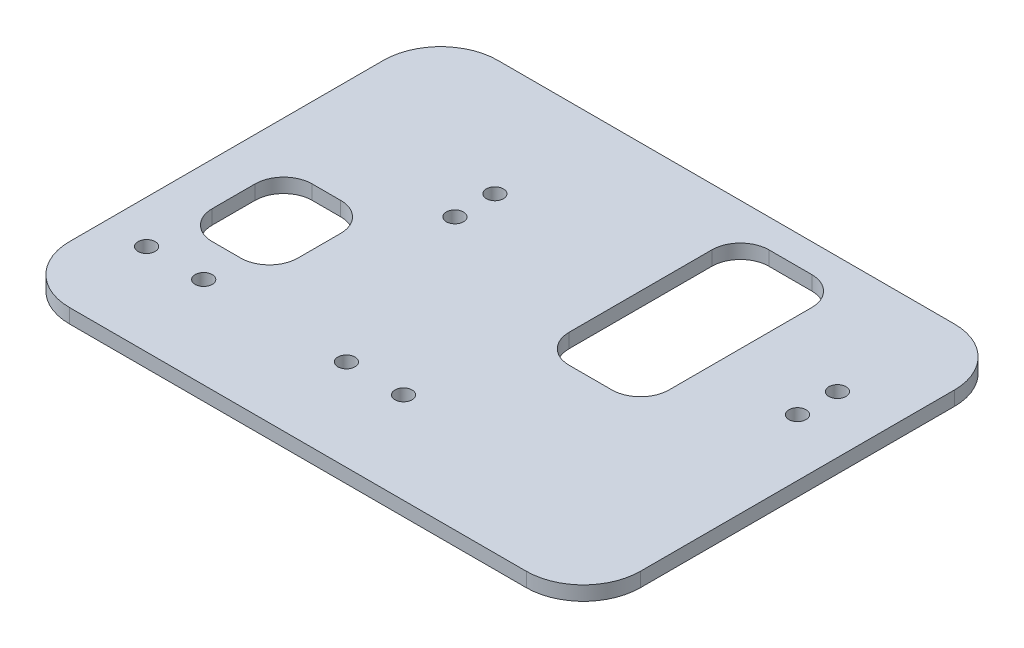
from build123d import *

# Parameters (mm, degrees)
SKETCH1_W           = 200
SKETCH1_H           = 150
BOSS_EXTRUDE1_DEPTH = 5
SKETCH3_R           = 3
CUT_EXTRUDE2_DEPTH  = 10
FILLET1_R           = 20


with BuildPart() as part:
    # Sketch1 → Boss-Extrude1 (new body)
    with BuildSketch(Plane(origin=(0, 0, 0), x_dir=(1, 0, 0), z_dir=(0, 1, 0))):
        with Locations((15, 0)):
            Rectangle(SKETCH1_W, SKETCH1_H)
    extrude(amount=BOSS_EXTRUDE1_DEPTH)

    # Sketch3 → Cut-Extrude2 (cut)
    with BuildSketch(Plane(origin=(0, 5, 0), x_dir=(1, 0, 0), z_dir=(0, 1, 0))):
        with Locations(Location((-70, -43, 0), (0, 0, 270))):
            Circle(SKETCH3_R)
        with Locations(Location((-50, -43, 0), (0, 0, 270))):
            Circle(SKETCH3_R)
        with Locations(Location((0, -43, 0), (0, 0, 270))):
            Circle(SKETCH3_R)
        with Locations(Location((20, -43, 0), (0, 0, 270))):
            Circle(SKETCH3_R)
        with Locations(Location((-25, 20, 0), (0, 0, 270))):
            Circle(SKETCH3_R)
        with Locations(Location((-25, 34, 0), (0, 0, 270))):
            Circle(SKETCH3_R)
        with Locations(Location((95, 20, 0), (0, 0, 270))):
            Circle(SKETCH3_R)
        with Locations(Location((95, 34, 0), (0, 0, 270))):
            Circle(SKETCH3_R)
        with BuildLine():
            Line((40, -5), (55, -5))
            ThreePointArc((55, -5), (62.071067812, -2.071067812), (65, 5))
            Line((65, 5), (65, 55))
            ThreePointArc((65, 55), (62.071067812, 62.071067812), (55, 65))
            Line((55, 65), (40, 65))
            ThreePointArc((40, 65), (32.928932188, 62.071067812), (30, 55))
            Line((30, 55), (30, 5))
            ThreePointArc((30, 5), (32.928932188, -2.071067812), (40, -5))
        make_face()
        with BuildLine():
            Line((-60, -30), (-50, -30))
            ThreePointArc((-50, -30), (-42.928932188, -27.071067812), (-40, -20))
            Line((-40, -20), (-40, -5))
            ThreePointArc((-40, -5), (-42.928932188, 2.071067812), (-50, 5))
            Line((-50, 5), (-60, 5))
            ThreePointArc((-60, 5), (-67.071067812, 2.071067812), (-70, -5))
            Line((-70, -5), (-70, -20))
            ThreePointArc((-70, -20), (-67.071067812, -27.071067812), (-60, -30))
        make_face()
    extrude(amount=-CUT_EXTRUDE2_DEPTH, mode=Mode.SUBTRACT)

    # Fillet1
    fillet1_edges = [part.edges().sort_by_distance(p)[0] for p in [
        (-85, 2.5, -75),
        (115, 2.5, -75),
        (115, 2.5, 75),
        (-85, 2.5, 75),
    ]]
    fillet(fillet1_edges, radius=FILLET1_R)


solid = part.part
